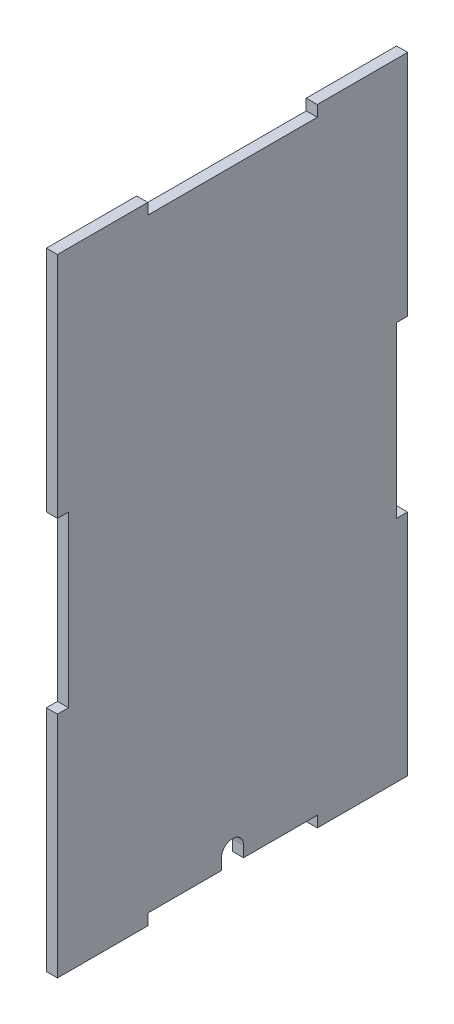
from build123d import *

# Parameters (mm, degrees)
SALIENTE_EXTRUIR1_DEPTH = 3


with BuildPart() as part:
    # Croquis1 → Saliente-Extruir1 (new body)
    with BuildSketch(Plane(origin=(0, 0, 0), x_dir=(0, 0, -1), z_dir=(1, 0, 0))):
        with BuildLine():
            Line((24.5, 167), (70.5, 167))
            Line((70.5, 167), (70.5, 170))
            Line((70.5, 170), (95, 170))
            Line((95, 170), (95, 108))
            Line((95, 108), (92, 108))
            Line((92, 108), (92, 62))
            Line((92, 62), (95, 62))
            Line((95, 62), (95, 0))
            Line((95, 0), (70.5, 0))
            Line((70.5, 0), (70.5, 3))
            Line((70.5, 3), (50.5, 3))
            Line((50.5, 3), (50.5, 6))
            ThreePointArc((50.5, 6), (47.5, 9), (44.5, 6))
            Line((44.5, 6), (44.5, 3))
            Line((44.5, 3), (24.5, 3))
            Line((24.5, 3), (24.5, 0))
            Line((24.5, 0), (0, 0))
            Line((0, 0), (0, 62))
            Line((0, 62), (3, 62))
            Line((3, 62), (3, 108))
            Line((3, 108), (0, 108))
            Line((0, 108), (0, 170))
            Line((0, 170), (24.5, 170))
            Line((24.5, 170), (24.5, 167))
        make_face()
    extrude(amount=SALIENTE_EXTRUIR1_DEPTH)


solid = part.part
